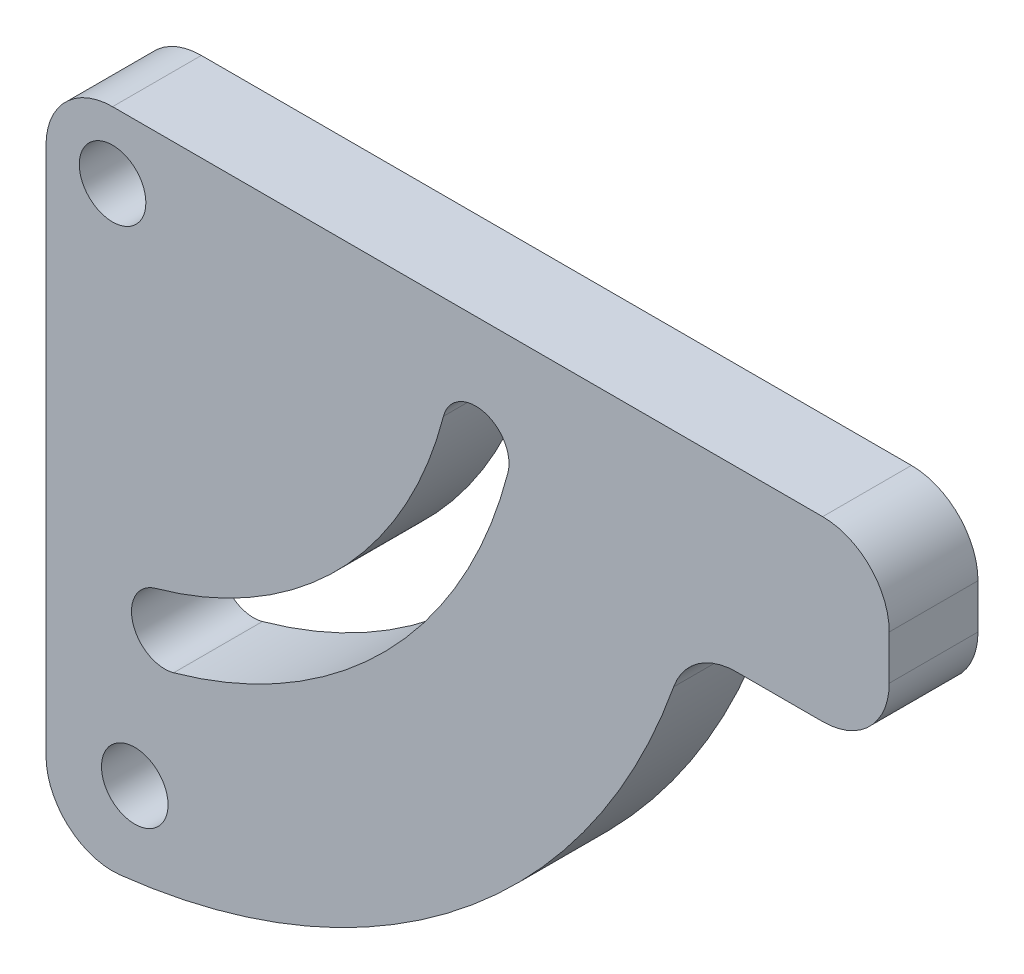
from build123d import *

# Parameters (mm, degrees)
SKETCH1_R           = 1.5
BOSS_EXTRUDE1_DEPTH = 4
FILLET1_R           = 3


with BuildPart() as part:
    # Sketch1 → Boss-Extrude1 (new body)
    with BuildSketch(Plane.XY):
        with BuildLine():
            Line((0, 0), (30, 0))
            Line((30, 0), (38, 0))
            Line((38, 0), (38, -8))
            Line((38, -8), (28.91366459, -8))
            ThreePointArc((28.91366459, -8), (18.165902125, -23.874672773), (0, -30))
            Line((0, -30), (0, 0))
        make_face()
        with Locations((4, -26)):
            Circle(SKETCH1_R, mode=Mode.SUBTRACT)
        with Locations((3, -3)):
            Circle(SKETCH1_R, mode=Mode.SUBTRACT)
        with BuildLine():
            ThreePointArc((4.950906496, -17.825221594), (3.907043109, -19.671934682), (5.753756198, -20.715798069))
            ThreePointArc((5.753756198, -20.715798069), (15.340798069, -15.063529288), (20.817285486, -5.375))
            ThreePointArc((20.817285486, -5.375), (19.739916731, -3.547631245), (17.912547976, -4.625))
            ThreePointArc((17.912547976, -4.625), (13.200221594, -12.961641481), (4.950906496, -17.825221594))
        make_face(mode=Mode.SUBTRACT)
    extrude(amount=BOSS_EXTRUDE1_DEPTH)

    # Fillet1
    fillet1_edges = [part.edges().sort_by_distance(p)[0] for p in [
        (0, 0, 2),
        (38, 0, 2),
        (38, -8, 2),
        (28.91366459, -8, 2),
        (0, -30, 2),
    ]]
    fillet(fillet1_edges, radius=FILLET1_R)


solid = part.part
